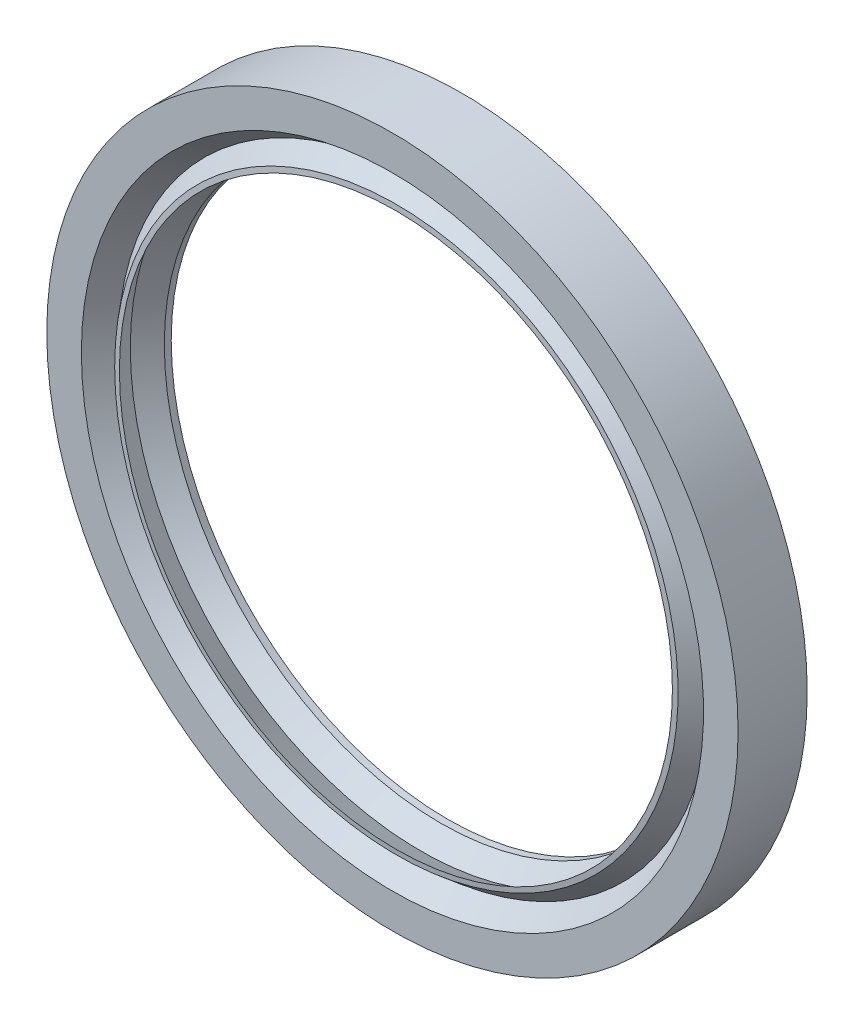
from build123d import *


with BuildPart() as part:
    # Sketch1 → Revolve1 (revolve)
    with BuildSketch(Plane(origin=(0, 0, 0), x_dir=(0, 0, -1), z_dir=(1, 0, 0)), mode=Mode.PRIVATE) as revolve1_sk:
        Polygon((10, 50), (0, 50), (0, 45), (3.069050459, 42.807821101), (0.573004994, 40.752995297), (0.5, 40), (4.129526922, 42.050337913), (7, 40), (8, 40), (2, 46), (2, 48), (10, 48), align=None)
    revolve(revolve1_sk.sketch.rotate(Axis((0, 0, 0), (0, 0, 1)), 90), axis=Axis((0, 0, 0), (0, 0, 1)))


solid = part.part
